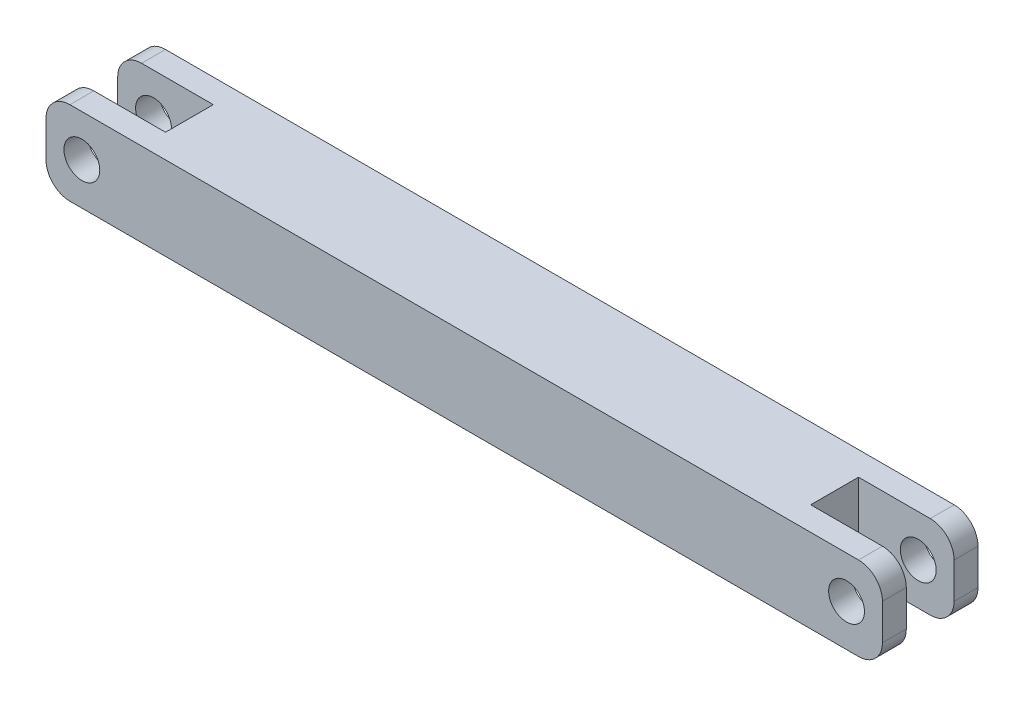
from build123d import *

# Parameters (mm, degrees)
SKETCH1_W           = 350
SKETCH1_H           = 35
BOSS_EXTRUDE1_DEPTH = 20
SKETCH2_W           = 80
SKETCH2_H           = 20
CUT_EXTRUDE1_DEPTH  = 178.006355818
SKETCH4_R           = 7.5
CUT_EXTRUDE2_DEPTH  = 178.006355818
FILLET1_R           = 10
FILLET2_R           = 10


with BuildPart() as part:
    # Sketch1 → Boss-Extrude1 (new, symmetric)
    with BuildSketch(Plane.XY):
        Rectangle(SKETCH1_W, SKETCH1_H)
    extrude(amount=BOSS_EXTRUDE1_DEPTH, both=True)

    # Sketch2 → Cut-Extrude1 (cut, symmetric)
    with BuildSketch(Plane(origin=(0, 0, 0), x_dir=(1, 0, 0), z_dir=(0, 1, 0))):
        with Locations((-175, 0)):
            Rectangle(SKETCH2_W, SKETCH2_H)
    cut_extrude1 = extrude(amount=CUT_EXTRUDE1_DEPTH, both=True, mode=Mode.SUBTRACT)

    # Sketch4 → Cut-Extrude2 (cut, symmetric)
    with BuildSketch(Plane.XY):
        with Locations((-160, 0)):
            Circle(SKETCH4_R)
    cut_extrude2 = extrude(amount=CUT_EXTRUDE2_DEPTH, both=True, mode=Mode.SUBTRACT)

    # Fillet1
    fillet1_edges = [part.edges().sort_by_distance(p)[0] for p in [
        (-175, -17.5, -15),
        (-175, 17.5, -15),
        (-175, -17.5, 15),
        (-175, 17.5, 15),
    ]]
    fillet(fillet1_edges, radius=FILLET1_R)

    # Mirror3: Cut-Extrude1, Cut-Extrude2 across plane
    add(cut_extrude1.mirror(Plane(origin=(0, 0, 0), x_dir=(0, 0, 1), z_dir=(1, 0, 0))), mode=Mode.SUBTRACT)
    add(cut_extrude2.mirror(Plane(origin=(0, 0, 0), x_dir=(0, 0, 1), z_dir=(1, 0, 0))), mode=Mode.SUBTRACT)

    # Fillet2
    fillet2_edges = [part.edges().sort_by_distance(p)[0] for p in [
        (175, -17.5, -15),
        (175, 17.5, -15),
        (175, -17.5, 15),
        (175, 17.5, 15),
    ]]
    fillet(fillet2_edges, radius=FILLET2_R)


solid = part.part
